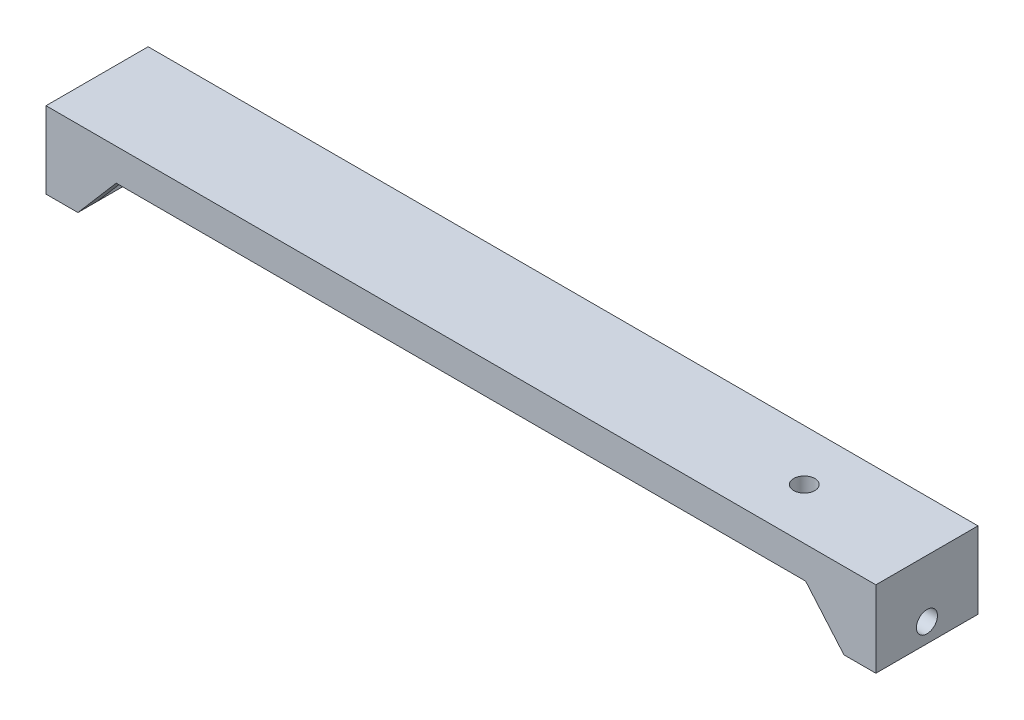
from build123d import *

# Parameters (mm, degrees)
EXTRUDE_2_DEPTH          = 16
CUT_EXTRUDE_1_DEPTH      = 127.589889012
CUT_EXTRUDE_1_DEPTH_BACK = 127.589889012
SKETCH_3_R               = 1.65
EXTRUDE_3_DEPTH          = 3
MIRROR_2_COPY_1_DEPTH    = 3
SKETCH_7_R               = 1.65
CUT_EXTRUDE_2_DEPTH      = 10


with BuildPart() as part:
    # 草图1 → 凸台-拉伸2 (new body)
    with BuildSketch(Plane.XY):
        Polygon((-65, 0), (65, 0), (65, -12), (60, -12), (60, -5), (-60, -5), (-60, -12), (-65, -12), align=None)
    extrude(amount=EXTRUDE_2_DEPTH)

    # 草图3 → 切除-拉伸1 (cut, two sides: drawn at the far end of the back side and taken through both)
    with BuildSketch(Plane(origin=(-60, 0, 0), x_dir=(0, 0, -1), z_dir=(1, 0, 0)).offset(-CUT_EXTRUDE_1_DEPTH_BACK)):
        with Locations(Location((-8, -9, 0), (0, 0, 90))):
            Circle(SKETCH_3_R)
    extrude(amount=CUT_EXTRUDE_1_DEPTH + CUT_EXTRUDE_1_DEPTH_BACK, mode=Mode.SUBTRACT)

    # 草图4 → 凸台-拉伸3 (add)
    with BuildSketch(Plane(origin=(0, 0, 0), x_dir=(-1, 0, 0), z_dir=(0, 0, -1))):
        Polygon((54, -5), (60, -12), (60, -5), align=None)
    extrude_3 = extrude(amount=-EXTRUDE_3_DEPTH)

    # 镜向1: 凸台-拉伸3 across plane
    add(extrude_3.mirror(Plane.XY.offset(8)))

    # 镜向2: 凸台-拉伸3 across plane
    add(extrude_3.mirror(Plane(origin=(0, 0, 0), x_dir=(0, 0, 1), z_dir=(1, 0, 0))))

    # 镜向2 copy 1 sketch → 镜向2 copy 1 (add)
    with BuildSketch(Plane.XY.offset(16)):
        Polygon((54, -5), (60, -12), (60, -5), align=None)
    extrude(amount=-MIRROR_2_COPY_1_DEPTH)

    # 草图7 → 切除-拉伸2 (cut)
    with BuildSketch(Plane(origin=(0, 0, 0), x_dir=(1, 0, 0), z_dir=(0, 1, 0))):
        with Locations(Location((45.79, -8, 0), (0, 0, 270))):
            Circle(SKETCH_7_R)
    extrude(amount=-CUT_EXTRUDE_2_DEPTH, mode=Mode.SUBTRACT)


solid = part.part
